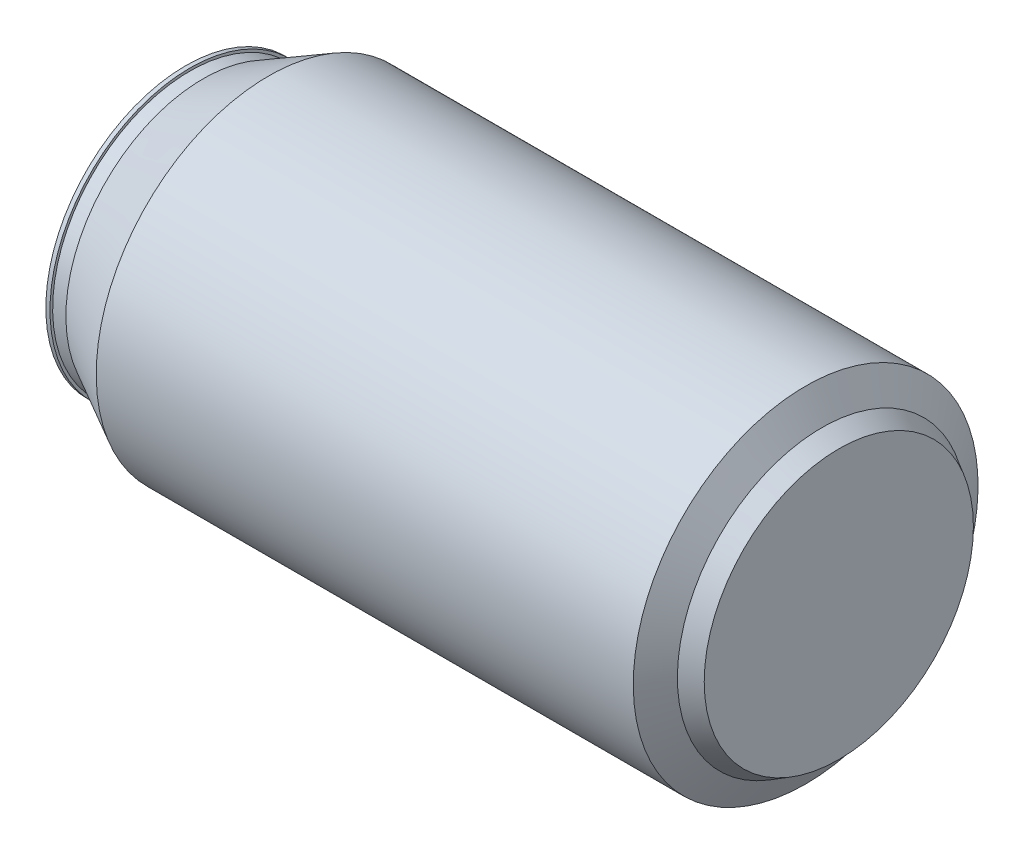
from build123d import *


with BuildPart() as part:
    # Sketch1 → Revolve1 (revolve)
    with BuildSketch(Plane.XY):
        Polygon((0, 0), (0, 26.797), (0.79375, 26.797), (0.79375, 26.289), (3.33375, 26.289), (15.875, 33.02), (118.745, 33.02), (121.839157898, 27.660761314), (125.095, 25.781), (125.095, 0), (124.30125, 0), (124.30125, 25.322728224), (121.258092569, 27.079695986), (118.286728224, 32.22625), (16.074544487, 32.22625), (3.533294487, 25.49525), (0.79375, 25.49525), (0.79375, 0), align=None)
    revolve(axis=Axis((-7.476944994, 0, 0), (1, 0, 0)))


solid = part.part
